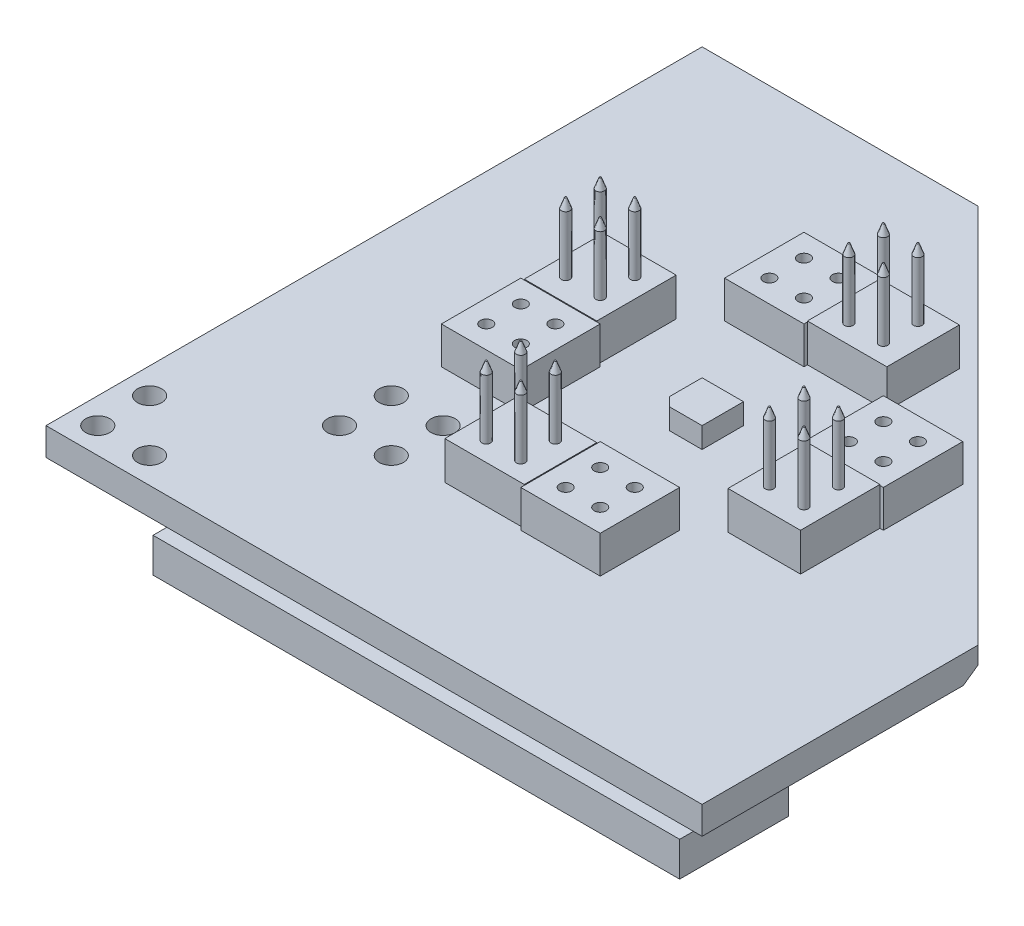
from build123d import *
from OCP.BRepFilletAPI import BRepFilletAPI_MakeChamfer

# Parameters (mm, degrees)
EXTRUDE1_DEPTH       = 1.6
SKETCH2_W            = 4.6
SKETCH2_H            = 4.6
EXTRUDE2_DEPTH       = 2.15
SKETCH3_W            = 4.6
SKETCH3_H            = 4.2
SKETCH3_W_2          = 4.2
SKETCH3_H_2          = 4.6
EXTRUDE3_DEPTH       = 2.2
SKETCH4_R            = 0.35
CUT_EXTRUDE1_DEPTH   = 2.15
SKETCH5_R            = 0.25
EXTRUDE4_DEPTH       = 4
CHAMFER1_SIZE        = 0.2
CHAMFER1_SIZE2       = 0.549495484
SKETCH6_W            = 6.3
SKETCH6_H            = 30.5
SKETCH6_W_2          = 30.5
SKETCH6_H_2          = 6.3
EXTRUDE5_DEPTH       = 2
SKETCH7_W            = 7
SKETCH7_H            = 7
EXTRUDE6_DEPTH       = 1
CHAMFER2_SIZE        = 0.6
EXTRUDE7_DEPTH       = 1.2
SKETCH9_W            = 2
SKETCH9_H            = 2
EXTRUDE8_DEPTH       = 0.9
EXTRUDE9_DEPTH       = 1
SKETCH11_W           = 1.6
SKETCH11_H           = 0.8
SKETCH11_W_2         = 0.8
SKETCH11_H_2         = 1.6
EXTRUDE10_DEPTH      = 0.5
EXTRUDE11_DEPTH      = 0.3
SKETCH13_W           = 6.68
SKETCH13_H           = 3.68
EXTRUDE12_DEPTH      = 1.5
SKETCH14_R           = 0.7
CUT_EXTRUDE2_DEPTH   = 30.067507633
EXTRUDE13_DEPTH      = 0.05
EXTRUDE13_DEPTH_BACK = 1.05
SKETCH15_R           = 0.7
SKETCH16_W           = 3.4
SKETCH16_H           = 1.7
EXTRUDE14_DEPTH      = 1.6
SKETCH17_W           = 1.2
SKETCH17_H           = 2.3
EXTRUDE15_DEPTH      = 1.3
SKETCH18_W           = 2
SKETCH18_H           = 1
EXTRUDE16_DEPTH      = 0.5
EXTRUDE17_DEPTH      = 0.3
SKETCH20_W           = 3.03
SKETCH20_H           = 1.43
EXTRUDE18_DEPTH      = 0.8


with BuildPart() as part:
    # Sketch1 → Extrude1 (new body)
    with BuildSketch(Plane(origin=(0, 0, 0), x_dir=(1, 0, 0), z_dir=(0, 1, 0))):
        Polygon((19, -3.019386745), (-3.019386745, 19), (-19, 19), (-19, -19), (19, -19), align=None)
    extrude(amount=EXTRUDE1_DEPTH)

    # Sketch2 → Extrude2 (add)
    with BuildSketch(Plane(origin=(0, 1.6, 0), x_dir=(-1, 0, 0), z_dir=(0, 1, 0))):
        with Locations((-8.2, -2.3)):
            Rectangle(SKETCH2_W, SKETCH2_H)
        with Locations((2.3, -8.2)):
            Rectangle(SKETCH2_W, SKETCH2_H)
        with Locations((-2.3, 8.2)):
            Rectangle(SKETCH2_W, SKETCH2_H)
        with Locations((8.2, 2.3)):
            Rectangle(SKETCH2_W, SKETCH2_H)
    extrude(amount=EXTRUDE2_DEPTH)

    # Sketch3 → Extrude3 (add)
    with BuildSketch(Plane(origin=(0, 1.6, 0), x_dir=(-1, 0, 0), z_dir=(0, 1, 0))):
        with Locations((-2.3, -8.2)):
            Rectangle(SKETCH3_W, SKETCH3_H)
        with Locations((-8.2, 2.3)):
            Rectangle(SKETCH3_W_2, SKETCH3_H_2)
        with Locations((2.3, 8.2)):
            Rectangle(SKETCH3_W, SKETCH3_H)
        with Locations((8.2, -2.3)):
            Rectangle(SKETCH3_W_2, SKETCH3_H_2)
    extrude(amount=EXTRUDE3_DEPTH)

    # Sketch4 → Cut-Extrude1 (cut)
    with BuildSketch(Plane(origin=(0, 3.75, 0), x_dir=(-1, 0, 0), z_dir=(0, 1, 0))):
        with Locations(Location((3.3, -9.2, 0), (0, 0, 90))):
            Circle(SKETCH4_R)
        with Locations(Location((1.3, -9.2, 0), (0, 0, 90))):
            Circle(SKETCH4_R)
        with Locations(Location((1.3, -7.2, 0), (0, 0, 90))):
            Circle(SKETCH4_R)
        with Locations(Location((3.3, -7.2, 0), (0, 0, 90))):
            Circle(SKETCH4_R)
        with Locations(Location((-9.2, -3.3, 0), (0, 0, 90))):
            Circle(SKETCH4_R)
        with Locations(Location((-9.2, -1.3, 0), (0, 0, 90))):
            Circle(SKETCH4_R)
        with Locations(Location((-7.2, -1.3, 0), (0, 0, 90))):
            Circle(SKETCH4_R)
        with Locations(Location((-7.2, -3.3, 0), (0, 0, 90))):
            Circle(SKETCH4_R)
        with Locations(Location((-3.3, 9.2, 0), (0, 0, 90))):
            Circle(SKETCH4_R)
        with Locations(Location((-1.3, 9.2, 0), (0, 0, 90))):
            Circle(SKETCH4_R)
        with Locations(Location((-1.3, 7.2, 0), (0, 0, 90))):
            Circle(SKETCH4_R)
        with Locations(Location((-3.3, 7.2, 0), (0, 0, 90))):
            Circle(SKETCH4_R)
        with Locations(Location((9.2, 3.3, 0), (0, 0, 90))):
            Circle(SKETCH4_R)
        with Locations(Location((9.2, 1.3, 0), (0, 0, 90))):
            Circle(SKETCH4_R)
        with Locations(Location((7.2, 1.3, 0), (0, 0, 90))):
            Circle(SKETCH4_R)
        with Locations(Location((7.2, 3.3, 0), (0, 0, 90))):
            Circle(SKETCH4_R)
    extrude(amount=-CUT_EXTRUDE1_DEPTH, mode=Mode.SUBTRACT)

    # Sketch5 → Extrude4 (add)
    with BuildSketch(Plane(origin=(0, 3.8, 0), x_dir=(-1, 0, 0), z_dir=(0, 1, 0))):
        with Locations(Location((-1.3, -9.2, 0), (0, 0, 270))):
            Circle(SKETCH5_R)
        with Locations(Location((-3.3, -9.2, 0), (0, 0, 270))):
            Circle(SKETCH5_R)
        with Locations(Location((-3.3, -7.2, 0), (0, 0, 270))):
            Circle(SKETCH5_R)
        with Locations(Location((-1.3, -7.2, 0), (0, 0, 270))):
            Circle(SKETCH5_R)
        with Locations(Location((-7.2, 1.3, 0), (0, 0, 270))):
            Circle(SKETCH5_R)
        with Locations(Location((-9.2, 1.3, 0), (0, 0, 90))):
            Circle(SKETCH5_R)
        with Locations(Location((-9.2, 3.3, 0), (0, 0, 270))):
            Circle(SKETCH5_R)
        with Locations(Location((-7.2, 3.3, 0), (0, 0, 90))):
            Circle(SKETCH5_R)
        with Locations(Location((1.3, 7.2, 0), (0, 0, 270))):
            Circle(SKETCH5_R)
        with Locations(Location((1.3, 9.2, 0), (0, 0, 90))):
            Circle(SKETCH5_R)
        with Locations(Location((3.3, 9.2, 0), (0, 0, 270))):
            Circle(SKETCH5_R)
        with Locations(Location((3.3, 7.2, 0), (0, 0, 90))):
            Circle(SKETCH5_R)
        with Locations(Location((7.2, -1.3, 0), (0, 0, 270))):
            Circle(SKETCH5_R)
        with Locations(Location((9.2, -1.3, 0), (0, 0, 90))):
            Circle(SKETCH5_R)
        with Locations(Location((9.2, -3.3, 0), (0, 0, 270))):
            Circle(SKETCH5_R)
        with Locations(Location((7.2, -3.3, 0), (0, 0, 90))):
            Circle(SKETCH5_R)
    extrude(amount=EXTRUDE4_DEPTH)

    # Chamfer1: one chamfer whose edges measure the first distance from different faces: ONE call of the kernel's chamfer builder (chamfer() names one face for all edges)
    chamfer1_edges_1 = [part.edges().sort_by_distance(p)[0] for p in [
        (1.3, 7.8, -8.95),
    ]]
    chamfer1_side_1 = [part.faces().sort_by_distance(p)[0] for p in [
        (1.3, 7.8, -9.2),
    ]]
    chamfer1_edges_2 = [part.edges().sort_by_distance(p)[0] for p in [
        (3.3, 7.8, -8.95),
    ]]
    chamfer1_side_2 = [part.faces().sort_by_distance(p)[0] for p in [
        (3.3, 7.8, -9.2),
    ]]
    chamfer1_edges_3 = [part.edges().sort_by_distance(p)[0] for p in [
        (3.3, 7.8, -6.95),
    ]]
    chamfer1_side_3 = [part.faces().sort_by_distance(p)[0] for p in [
        (3.3, 7.8, -7.2),
    ]]
    chamfer1_edges_4 = [part.edges().sort_by_distance(p)[0] for p in [
        (1.3, 7.8, -6.95),
    ]]
    chamfer1_side_4 = [part.faces().sort_by_distance(p)[0] for p in [
        (1.3, 7.8, -7.2),
    ]]
    chamfer1_edges_5 = [part.edges().sort_by_distance(p)[0] for p in [
        (9.2, 7.8, 1.05),
    ]]
    chamfer1_side_5 = [part.faces().sort_by_distance(p)[0] for p in [
        (9.2, 7.8, 1.3),
    ]]
    chamfer1_edges_6 = [part.edges().sort_by_distance(p)[0] for p in [
        (9.2, 7.8, 3.55),
    ]]
    chamfer1_side_6 = [part.faces().sort_by_distance(p)[0] for p in [
        (9.2, 7.8, 3.3),
    ]]
    chamfer1_edges_7 = [part.edges().sort_by_distance(p)[0] for p in [
        (7.2, 7.8, 3.05),
    ]]
    chamfer1_side_7 = [part.faces().sort_by_distance(p)[0] for p in [
        (7.2, 7.8, 3.3),
    ]]
    chamfer1_edges_8 = [part.edges().sort_by_distance(p)[0] for p in [
        (7.2, 7.8, 1.55),
    ]]
    chamfer1_side_8 = [part.faces().sort_by_distance(p)[0] for p in [
        (7.2, 7.8, 1.3),
    ]]
    chamfer1_edges_9 = [part.edges().sort_by_distance(p)[0] for p in [
        (-1.3, 7.8, 8.95),
    ]]
    chamfer1_side_9 = [part.faces().sort_by_distance(p)[0] for p in [
        (-1.3, 7.8, 9.2),
    ]]
    chamfer1_edges_10 = [part.edges().sort_by_distance(p)[0] for p in [
        (-3.3, 7.8, 9.45),
    ]]
    chamfer1_side_10 = [part.faces().sort_by_distance(p)[0] for p in [
        (-3.3, 7.8, 9.2),
    ]]
    chamfer1_edges_11 = [part.edges().sort_by_distance(p)[0] for p in [
        (-3.3, 7.8, 6.95),
    ]]
    chamfer1_side_11 = [part.faces().sort_by_distance(p)[0] for p in [
        (-3.3, 7.8, 7.2),
    ]]
    chamfer1_edges_12 = [part.edges().sort_by_distance(p)[0] for p in [
        (-1.3, 7.8, 7.45),
    ]]
    chamfer1_side_12 = [part.faces().sort_by_distance(p)[0] for p in [
        (-1.3, 7.8, 7.2),
    ]]
    chamfer1_edges_13 = [part.edges().sort_by_distance(p)[0] for p in [
        (-9.2, 7.8, -1.55),
    ]]
    chamfer1_side_13 = [part.faces().sort_by_distance(p)[0] for p in [
        (-9.2, 7.8, -1.3),
    ]]
    chamfer1_edges_14 = [part.edges().sort_by_distance(p)[0] for p in [
        (-9.2, 7.8, -3.05),
    ]]
    chamfer1_side_14 = [part.faces().sort_by_distance(p)[0] for p in [
        (-9.2, 7.8, -3.3),
    ]]
    chamfer1_edges_15 = [part.edges().sort_by_distance(p)[0] for p in [
        (-7.2, 7.8, -3.55),
    ]]
    chamfer1_side_15 = [part.faces().sort_by_distance(p)[0] for p in [
        (-7.2, 7.8, -3.3),
    ]]
    chamfer1_edges_16 = [part.edges().sort_by_distance(p)[0] for p in [
        (-7.2, 7.8, -1.05),
    ]]
    chamfer1_side_16 = [part.faces().sort_by_distance(p)[0] for p in [
        (-7.2, 7.8, -1.3),
    ]]
    chamfer1 = BRepFilletAPI_MakeChamfer(part.part.solid().wrapped)
    for e in chamfer1_edges_1:
        chamfer1.Add(CHAMFER1_SIZE, CHAMFER1_SIZE2, e.wrapped, chamfer1_side_1[0].wrapped)  # the first distance lies on this face
    for e in chamfer1_edges_2:
        chamfer1.Add(CHAMFER1_SIZE, CHAMFER1_SIZE2, e.wrapped, chamfer1_side_2[0].wrapped)  # the first distance lies on this face
    for e in chamfer1_edges_3:
        chamfer1.Add(CHAMFER1_SIZE, CHAMFER1_SIZE2, e.wrapped, chamfer1_side_3[0].wrapped)  # the first distance lies on this face
    for e in chamfer1_edges_4:
        chamfer1.Add(CHAMFER1_SIZE, CHAMFER1_SIZE2, e.wrapped, chamfer1_side_4[0].wrapped)  # the first distance lies on this face
    for e in chamfer1_edges_5:
        chamfer1.Add(CHAMFER1_SIZE, CHAMFER1_SIZE2, e.wrapped, chamfer1_side_5[0].wrapped)  # the first distance lies on this face
    for e in chamfer1_edges_6:
        chamfer1.Add(CHAMFER1_SIZE, CHAMFER1_SIZE2, e.wrapped, chamfer1_side_6[0].wrapped)  # the first distance lies on this face
    for e in chamfer1_edges_7:
        chamfer1.Add(CHAMFER1_SIZE, CHAMFER1_SIZE2, e.wrapped, chamfer1_side_7[0].wrapped)  # the first distance lies on this face
    for e in chamfer1_edges_8:
        chamfer1.Add(CHAMFER1_SIZE, CHAMFER1_SIZE2, e.wrapped, chamfer1_side_8[0].wrapped)  # the first distance lies on this face
    for e in chamfer1_edges_9:
        chamfer1.Add(CHAMFER1_SIZE, CHAMFER1_SIZE2, e.wrapped, chamfer1_side_9[0].wrapped)  # the first distance lies on this face
    for e in chamfer1_edges_10:
        chamfer1.Add(CHAMFER1_SIZE, CHAMFER1_SIZE2, e.wrapped, chamfer1_side_10[0].wrapped)  # the first distance lies on this face
    for e in chamfer1_edges_11:
        chamfer1.Add(CHAMFER1_SIZE, CHAMFER1_SIZE2, e.wrapped, chamfer1_side_11[0].wrapped)  # the first distance lies on this face
    for e in chamfer1_edges_12:
        chamfer1.Add(CHAMFER1_SIZE, CHAMFER1_SIZE2, e.wrapped, chamfer1_side_12[0].wrapped)  # the first distance lies on this face
    for e in chamfer1_edges_13:
        chamfer1.Add(CHAMFER1_SIZE, CHAMFER1_SIZE2, e.wrapped, chamfer1_side_13[0].wrapped)  # the first distance lies on this face
    for e in chamfer1_edges_14:
        chamfer1.Add(CHAMFER1_SIZE, CHAMFER1_SIZE2, e.wrapped, chamfer1_side_14[0].wrapped)  # the first distance lies on this face
    for e in chamfer1_edges_15:
        chamfer1.Add(CHAMFER1_SIZE, CHAMFER1_SIZE2, e.wrapped, chamfer1_side_15[0].wrapped)  # the first distance lies on this face
    for e in chamfer1_edges_16:
        chamfer1.Add(CHAMFER1_SIZE, CHAMFER1_SIZE2, e.wrapped, chamfer1_side_16[0].wrapped)  # the first distance lies on this face
    add(Compound.cast(chamfer1.Shape()), mode=Mode.REPLACE)

    # Sketch6 → Extrude5 (add)
    with BuildSketch(Plane.XZ):
        with Locations((-16.65, -3.25)):
            Rectangle(SKETCH6_W, SKETCH6_H)
        with Locations((3.25, 16.65)):
            Rectangle(SKETCH6_W_2, SKETCH6_H_2)
    extrude(amount=EXTRUDE5_DEPTH)

    # Sketch7 → Extrude6 (add)
    with BuildSketch(Plane.XZ):
        with Locations((-5.25, -0.25)):
            Rectangle(SKETCH7_W, SKETCH7_H)
    extrude(amount=EXTRUDE6_DEPTH)

    # Chamfer2
    chamfer2_edges = [part.edges().sort_by_distance(p)[0] for p in [
        (7.990306627, 0, -7.990306627),
    ]]
    chamfer(chamfer2_edges, length=CHAMFER2_SIZE)

    # Sketch8 → Extrude7 (add)
    with BuildSketch(Plane(origin=(0, 1.6, 0), x_dir=(-1, 0, 0), z_dir=(0, 1, 0))):
        Polygon((1.2, 0.7), (0.7, 1.2), (-1.2, 1.2), (-1.2, -1.2), (1.2, -1.2), align=None)
    extrude(amount=EXTRUDE7_DEPTH)

    # Sketch9 → Extrude8 (add)
    with BuildSketch(Plane.XZ):
        with Locations((8.5, 0.7)):
            Rectangle(SKETCH9_W, SKETCH9_H)
        with Locations((-1.35, 5.15)):
            Rectangle(SKETCH9_W, SKETCH9_H)
    extrude(amount=EXTRUDE8_DEPTH)

    # Sketch10 → Extrude9 (add)
    with BuildSketch(Plane.XZ):
        with BuildLine():
            Line((1.35, 2.8), (0.6, 2.8))
            ThreePointArc((0.6, 2.8), (0.458578644, 2.741421356), (0.4, 2.6))
            Line((0.4, 2.6), (0.4, -0.2))
            ThreePointArc((0.4, -0.2), (0.458578644, -0.341421356), (0.6, -0.4))
            Line((0.6, -0.4), (1.35, -0.4))
            ThreePointArc((1.35, -0.4), (1.491421356, -0.341421356), (1.55, -0.2))
            Line((1.55, -0.2), (1.55, 2.6))
            ThreePointArc((1.55, 2.6), (1.491421356, 2.741421356), (1.35, 2.8))
        make_face()
    extrude(amount=EXTRUDE9_DEPTH)

    # Sketch11 → Extrude10 (add)
    with BuildSketch(Plane.XZ):
        with Locations((8.55, 6.5)):
            Rectangle(SKETCH11_W, SKETCH11_H)
        with Locations((-10.55, -6.1)):
            Rectangle(SKETCH11_W_2, SKETCH11_H_2)
        with Locations((-3.3, -14.05)):
            Rectangle(SKETCH11_W_2, SKETCH11_H_2)
        with Locations((-0.7, -11.3)):
            Rectangle(SKETCH11_W_2, SKETCH11_H_2)
    extrude(amount=EXTRUDE10_DEPTH)

    # Sketch12 → Extrude11 (add)
    with BuildSketch(Plane.XZ):
        Polygon((-11.3, -16.3), (-9.6, -16.3), (-9.6, -18.2), (-6.4, -18.2), (-6.4, -16.3), (-4.6, -16.3), (-4.6, -12.6), (-5.3, -12.6), (-5.3, -10.7), (-6.2, -10.7), (-6.2, -12.6), (-7.55, -12.6), (-7.55, -10.7), (-8.45, -10.7), (-8.45, -12.6), (-9.7, -12.6), (-9.7, -10.7), (-10.6, -10.7), (-10.6, -12.6), (-11.3, -12.6), align=None)
    extrude(amount=EXTRUDE11_DEPTH)

    # Sketch13 → Extrude12 (add)
    with BuildSketch(Plane.XZ.offset(0.3)):
        with Locations((-7.95, -14.45)):
            Rectangle(SKETCH13_W, SKETCH13_H)
    extrude(amount=EXTRUDE12_DEPTH)

    # Sketch14 → Cut-Extrude2 (cut, through all)
    with BuildSketch(Plane.XZ):
        with Locations(Location((-17.5, 17.5, 0), (0, 0, 270))):
            Circle(SKETCH14_R)
        with Locations(Location((-17.5, 14.5, 0), (0, 0, 270))):
            Circle(SKETCH14_R)
        with Locations(Location((-10.5, 10.5, 0), (0, 0, 270))):
            Circle(SKETCH14_R)
        with Locations(Location((-7.5, 7.5, 0), (0, 0, 270))):
            Circle(SKETCH14_R)
        with Locations(Location((-10.5, 7.5, 0), (0, 0, 270))):
            Circle(SKETCH14_R)
        with Locations(Location((-14.5, 17.5, 0), (0, 0, 90))):
            Circle(SKETCH14_R)
        with Locations(Location((-7.5, 10.5, 0), (0, 0, 90))):
            Circle(SKETCH14_R)
    extrude(amount=-CUT_EXTRUDE2_DEPTH, mode=Mode.SUBTRACT)

    # Sketch15 → Extrude13 (add, two sides: drawn at the far end of the back side and taken through both)
    # profile 1 of 7: a face of its own
    with BuildSketch(Plane.XZ.offset(-EXTRUDE13_DEPTH_BACK)):
        Polygon((-8.6, 7.044365081), (-7.955634919, 6.4), (-7.044365081, 6.4), (-6.4, 7.044365081), (-6.4, 7.955634919), (-7.044365081, 8.6), (-7.955634919, 8.6), (-8.6, 7.955634919), align=None)
        with Locations(Location((-7.5, 7.5, 0), (0, 0, 270))):
            Circle(SKETCH15_R, mode=Mode.SUBTRACT)
    # profile 2 of 7: a face of its own
    with BuildSketch(Plane.XZ.offset(-EXTRUDE13_DEPTH_BACK)):
        Polygon((-11.6, 7.044365081), (-10.955634919, 6.4), (-10.044365081, 6.4), (-9.4, 7.044365081), (-9.4, 7.955634919), (-10.044365081, 8.6), (-10.955634919, 8.6), (-11.6, 7.955634919), align=None)
        with Locations(Location((-10.5, 7.5, 0), (0, 0, 270))):
            Circle(SKETCH15_R, mode=Mode.SUBTRACT)
    # profile 3 of 7: a face of its own
    with BuildSketch(Plane.XZ.offset(-EXTRUDE13_DEPTH_BACK)):
        Polygon((-8.6, 10.044365081), (-7.955634919, 9.4), (-7.044365081, 9.4), (-6.4, 10.044365081), (-6.4, 10.955634919), (-7.044365081, 11.6), (-7.955634919, 11.6), (-8.6, 10.955634919), align=None)
        with Locations(Location((-7.5, 10.5, 0), (0, 0, 270))):
            Circle(SKETCH15_R, mode=Mode.SUBTRACT)
    # profile 4 of 7: a face of its own
    with BuildSketch(Plane.XZ.offset(-EXTRUDE13_DEPTH_BACK)):
        Polygon((-11.6, 10.044365081), (-10.955634919, 9.4), (-10.044365081, 9.4), (-9.4, 10.044365081), (-9.4, 10.955634919), (-10.044365081, 11.6), (-10.955634919, 11.6), (-11.6, 10.955634919), align=None)
        with Locations(Location((-10.5, 10.5, 0), (0, 0, 270))):
            Circle(SKETCH15_R, mode=Mode.SUBTRACT)
    # profile 5 of 7: a face of its own
    with BuildSketch(Plane.XZ.offset(-EXTRUDE13_DEPTH_BACK)):
        Polygon((-18.6, 14.044365081), (-17.955634919, 13.4), (-17.044365081, 13.4), (-16.4, 14.044365081), (-16.4, 14.955634919), (-17.044365081, 15.6), (-17.955634919, 15.6), (-18.6, 14.955634919), align=None)
        with Locations(Location((-17.5, 14.5, 0), (0, 0, 270))):
            Circle(SKETCH15_R, mode=Mode.SUBTRACT)
    # profile 6 of 7: a face of its own
    with BuildSketch(Plane.XZ.offset(-EXTRUDE13_DEPTH_BACK)):
        Polygon((-18.6, 17.044365081), (-17.955634919, 16.4), (-17.044365081, 16.4), (-16.4, 17.044365081), (-16.4, 17.955634919), (-17.044365081, 18.6), (-17.955634919, 18.6), (-18.6, 17.955634919), align=None)
        with Locations(Location((-17.5, 17.5, 0), (0, 0, 270))):
            Circle(SKETCH15_R, mode=Mode.SUBTRACT)
    # profile 7 of 7: a face of its own
    with BuildSketch(Plane.XZ.offset(-EXTRUDE13_DEPTH_BACK)):
        Polygon((-15.6, 17.044365081), (-14.955634919, 16.4), (-14.044365081, 16.4), (-13.4, 17.044365081), (-13.4, 17.955634919), (-14.044365081, 18.6), (-14.955634919, 18.6), (-15.6, 17.955634919), align=None)
        with Locations(Location((-14.5, 17.5, 0), (0, 0, 270))):
            Circle(SKETCH15_R, mode=Mode.SUBTRACT)
    extrude(amount=EXTRUDE13_DEPTH + EXTRUDE13_DEPTH_BACK)

    # Sketch16 → Extrude14 (add)
    with BuildSketch(Plane.XZ):
        with Locations((-8.9, -9.05)):
            Rectangle(SKETCH16_W, SKETCH16_H)
    extrude(amount=EXTRUDE14_DEPTH)

    # Sketch17 → Extrude15 (add)
    with BuildSketch(Plane.XZ):
        with Locations((-8.65, -6.15)):
            Rectangle(SKETCH17_W, SKETCH17_H)
    extrude(amount=EXTRUDE15_DEPTH)

    # Sketch18 → Extrude16 (add)
    with BuildSketch(Plane.XZ):
        with Locations((-2.65, -11.55)):
            Rectangle(SKETCH18_W, SKETCH18_H)
    extrude(amount=EXTRUDE16_DEPTH)

    # Sketch19 → Extrude17 (add)
    with BuildSketch(Plane.XZ):
        Polygon((-0.8, -8.45), (0.45, -8.45), (0.45, -9.05), (0.95, -9.05), (0.95, -8.45), (2.25, -8.45), (2.25, -7), (1.95, -7), (1.95, -6.4), (1.45, -6.4), (1.45, -7), (0, -7), (0, -6.4), (-0.5, -6.4), (-0.5, -7), (-0.8, -7), align=None)
    extrude(amount=EXTRUDE17_DEPTH)

    # Sketch20 → Extrude18 (add)
    with BuildSketch(Plane.XZ.offset(0.3)):
        with Locations((0.725, -7.725)):
            Rectangle(SKETCH20_W, SKETCH20_H)
    extrude(amount=EXTRUDE18_DEPTH)


solid = part.part
